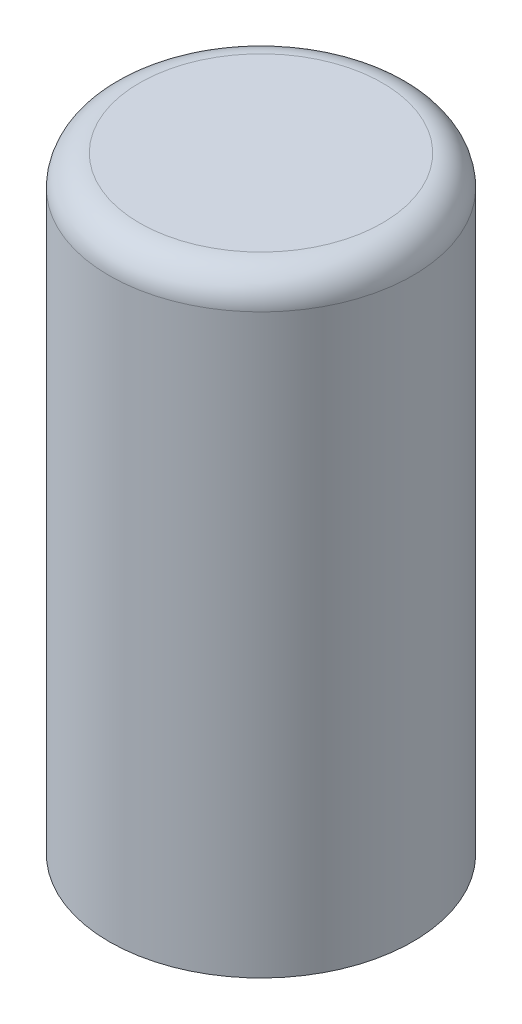
from build123d import *

# Parameters (mm, degrees)
SKETCH1_R           = 5
BOSS_EXTRUDE1_DEPTH = 20
FILLET1_R           = 1
CUT_EXTRUDE1_DEPTH  = 15
SKETCH4_R           = 3.05
CUT_EXTRUDE2_DEPTH  = 3


with BuildPart() as part:
    # Sketch1 → Boss-Extrude1 (new body)
    with BuildSketch(Plane(origin=(0, 0, 0), x_dir=(1, 0, 0), z_dir=(0, 1, 0))):
        with Locations(Location((0, 0, 0), (0, 0, 270))):
            Circle(SKETCH1_R)
    extrude(amount=BOSS_EXTRUDE1_DEPTH)

    # Fillet1
    fillet1_edges = [part.edges().sort_by_distance(p)[0] for p in [
        (0, 20, -5),
    ]]
    fillet(fillet1_edges, radius=FILLET1_R)

    # Sketch2 → Cut-Extrude1 (cut)
    with BuildSketch(Plane(origin=(0, 0, 0), x_dir=(-1, 0, 0), z_dir=(0, -1, 0))):
        with BuildLine():
            ThreePointArc((1.44, 2.688661377), (-3.05, 0), (1.44, -2.688661377))
            Line((1.44, -2.688661377), (1.44, 2.688661377))
        make_face()
    extrude(amount=-CUT_EXTRUDE1_DEPTH, mode=Mode.SUBTRACT)

    # Sketch4 → Cut-Extrude2 (cut)
    with BuildSketch(Plane(origin=(0, 0, 0), x_dir=(-1, 0, 0), z_dir=(0, -1, 0))):
        with Locations(Location((0, 0, 0), (0, 0, 90))):
            Circle(SKETCH4_R)
    extrude(amount=-CUT_EXTRUDE2_DEPTH, mode=Mode.SUBTRACT)


solid = part.part
